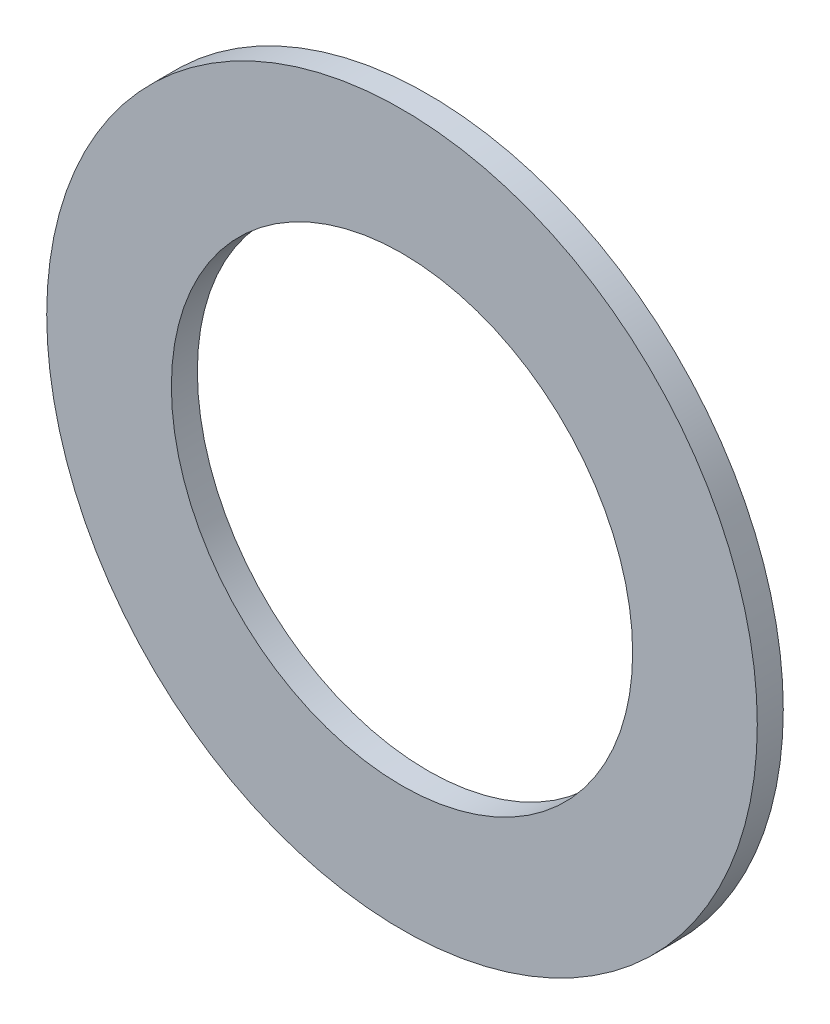
from build123d import *

# Parameters (mm, degrees)
SKETCH1_R           = 5.55625
SKETCH1_R_2         = 3.6068
BOSS_EXTRUDE1_DEPTH = 0.4064


with BuildPart() as part:
    # Sketch1 → Boss-Extrude1 (new body)
    with BuildSketch(Plane.XY):
        Circle(SKETCH1_R)
        Circle(SKETCH1_R_2, mode=Mode.SUBTRACT)
    extrude(amount=BOSS_EXTRUDE1_DEPTH)


solid = part.part
